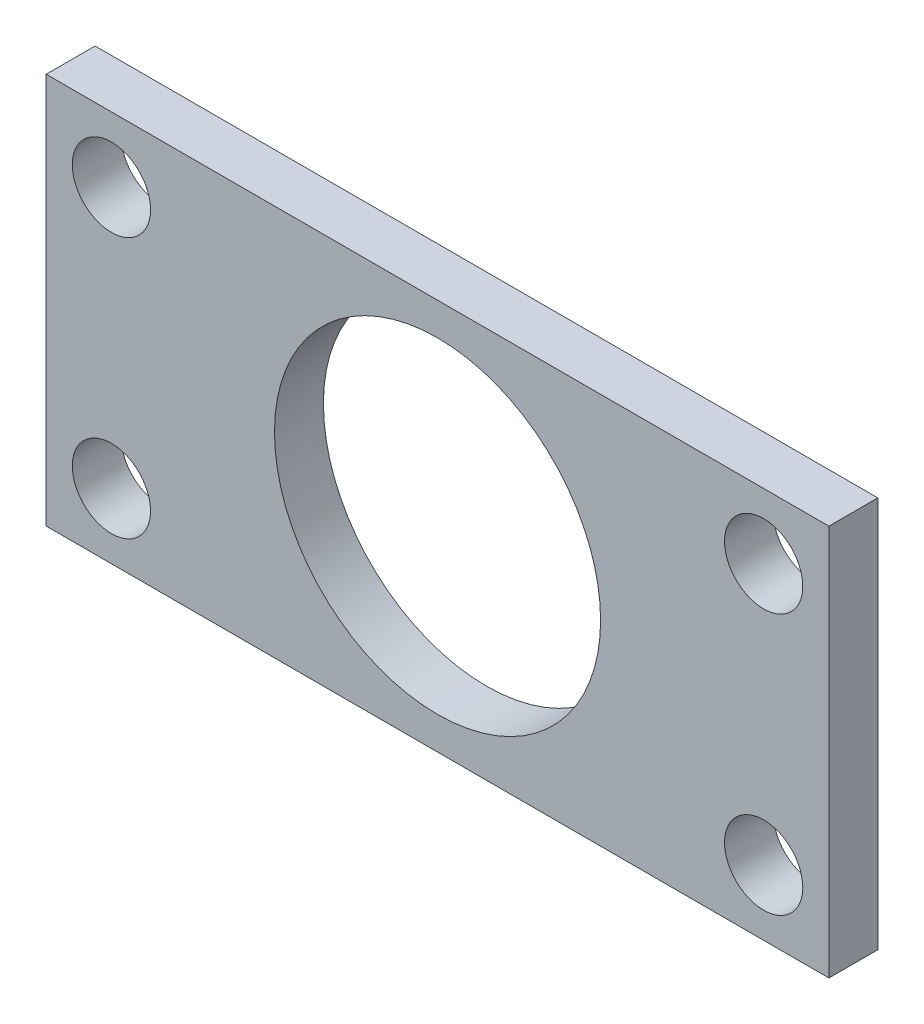
from build123d import *

# Parameters (mm, degrees)
SKETCH1_W           = 24
SKETCH1_H           = 12
SKETCH1_R           = 1.2
SKETCH1_R_2         = 5
BOSS_EXTRUDE1_DEPTH = 1.5


with BuildPart() as part:
    # Sketch1 → Boss-Extrude1 (new body)
    with BuildSketch(Plane.XY):
        with Locations((12, 6)):
            Rectangle(SKETCH1_W, SKETCH1_H)
        with Locations((2, 10)):
            Circle(SKETCH1_R, mode=Mode.SUBTRACT)
        with Locations(Location((22, 10, 0), (0, 0, 180))):
            Circle(SKETCH1_R, mode=Mode.SUBTRACT)
        with Locations((22, 2)):
            Circle(SKETCH1_R, mode=Mode.SUBTRACT)
        with Locations(Location((2, 2, 0), (0, 0, 180))):
            Circle(SKETCH1_R, mode=Mode.SUBTRACT)
        with Locations((12, 6)):
            Circle(SKETCH1_R_2, mode=Mode.SUBTRACT)
    extrude(amount=BOSS_EXTRUDE1_DEPTH)


solid = part.part
